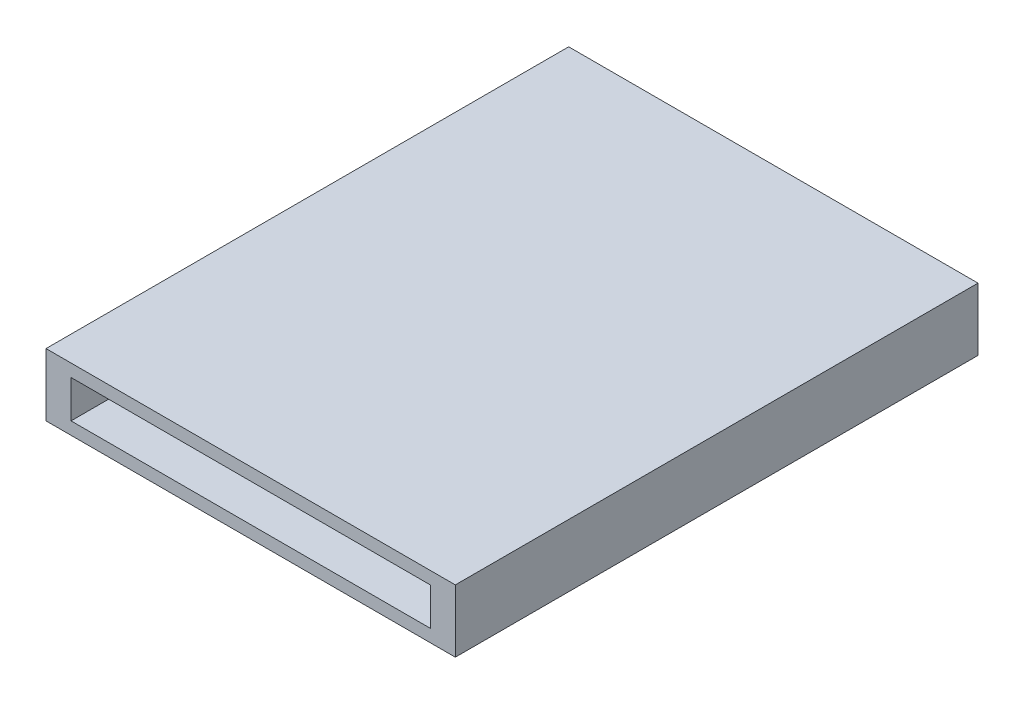
from build123d import *

# Parameters (mm, degrees)
SKETCH1_W           = 16.337019791
SKETCH1_H           = 20.861117579
BOSS_EXTRUDE1_DEPTH = 2.5
SKETCH2_W           = 14.337019791
SKETCH2_H           = 1.5
CUT_EXTRUDE1_DEPTH  = 20.7


with BuildPart() as part:
    # Sketch1 → Boss-Extrude1 (new body)
    with BuildSketch(Plane(origin=(0, 0, 0), x_dir=(1, 0, 0), z_dir=(0, 1, 0))):
        with Locations((-48.653803358, 19.855762515)):
            Rectangle(SKETCH1_W, SKETCH1_H)
    extrude(amount=BOSS_EXTRUDE1_DEPTH)

    # Sketch2 → Cut-Extrude1 (cut)
    with BuildSketch(Plane.XY.offset(-9.425203725)):
        with Locations((-48.653803358, 1.25)):
            Rectangle(SKETCH2_W, SKETCH2_H)
    extrude(amount=-CUT_EXTRUDE1_DEPTH, mode=Mode.SUBTRACT)


solid = part.part
